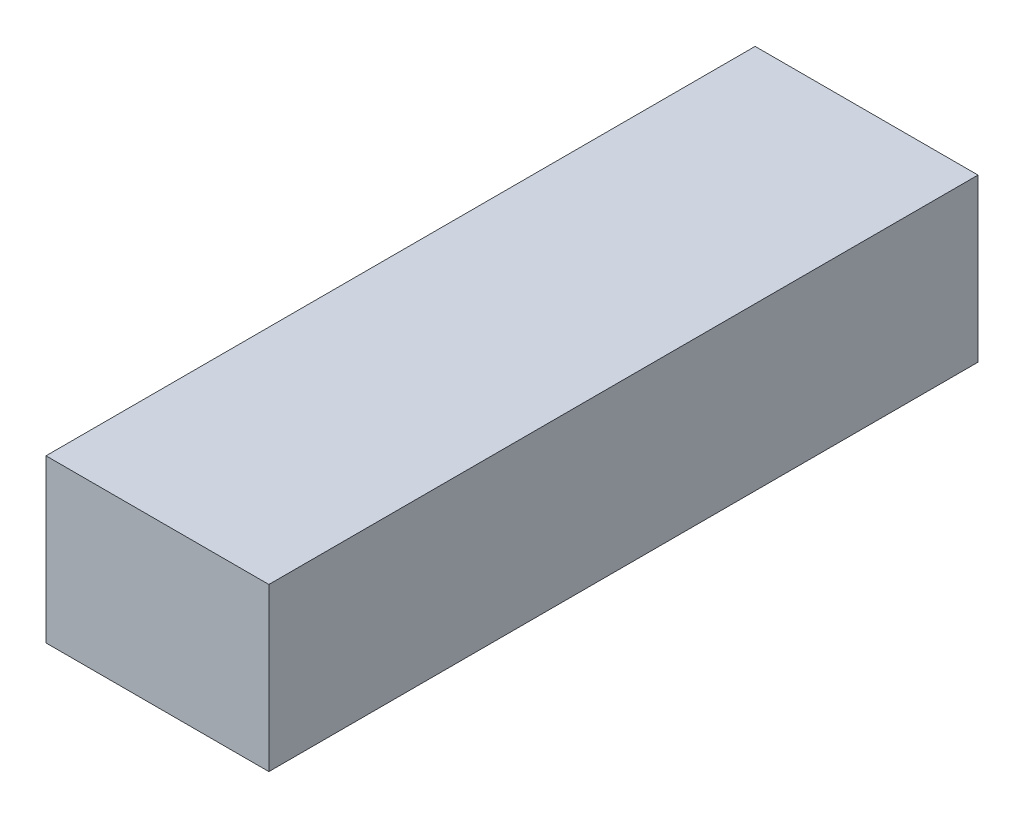
from build123d import *

# Parameters (mm, degrees)
SKETCH1_W           = 33
SKETCH1_H           = 105
BOSS_EXTRUDE1_DEPTH = 24


with BuildPart() as part:
    # Sketch1 → Boss-Extrude1 (new body)
    with BuildSketch(Plane(origin=(0, 0, 0), x_dir=(1, 0, 0), z_dir=(0, 1, 0))):
        Rectangle(SKETCH1_W, SKETCH1_H)
    extrude(amount=BOSS_EXTRUDE1_DEPTH)


solid = part.part
